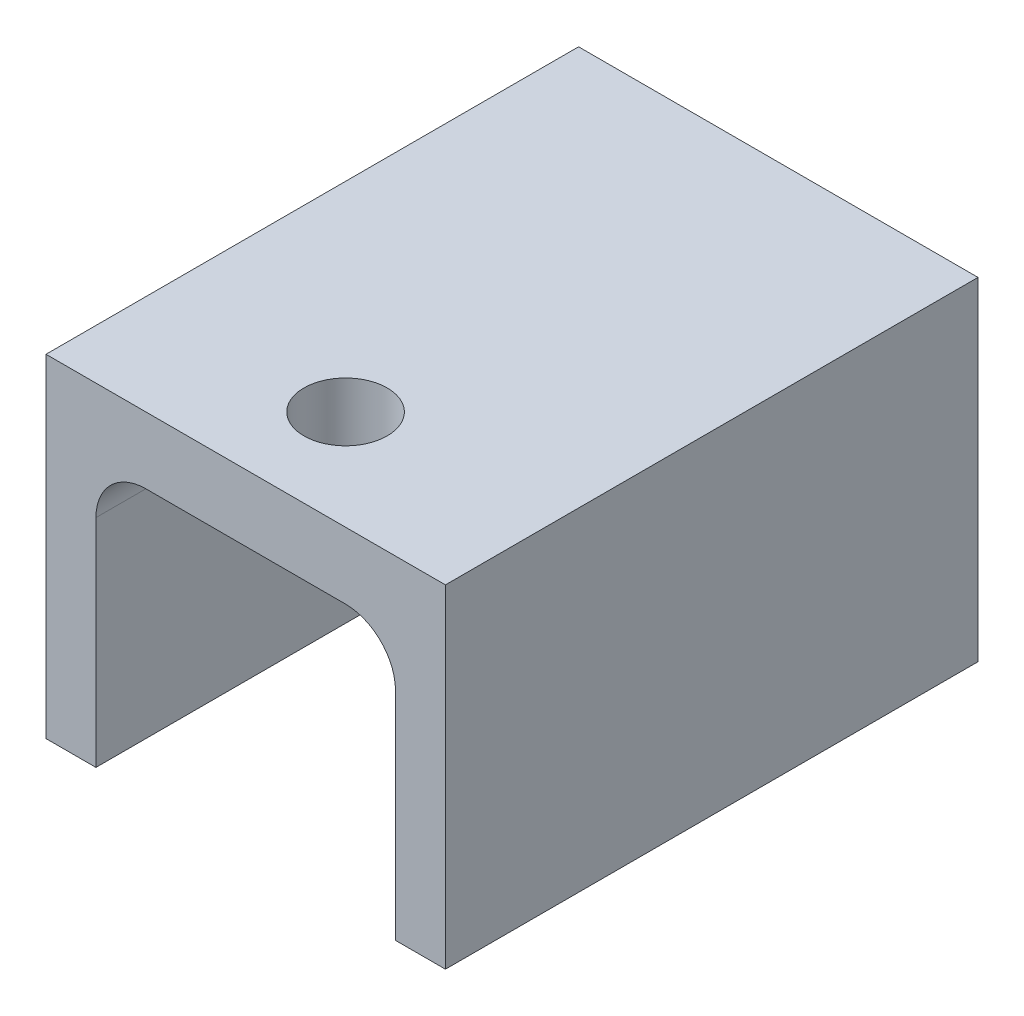
from build123d import *

# Parameters (mm, degrees)
SKETCH_1_W          = 18
SKETCH_1_H          = 20
EXTRUDE_1_DEPTH     = 4
SKETCH_2_W          = 18
SKETCH_2_H          = 4
EXTRUDE_2_DEPTH     = 28
SKETCH_3_R          = 2.5
CUT_EXTRUDE_1_DEPTH = 37.891733491
SKETCH_4_R          = 1.5
CUT_EXTRUDE_2_DEPTH = 32
EXTRUDE_3_DEPTH     = 3
EXTRUDE_4_DEPTH     = 3
EXTRUDE_5_DEPTH     = 3
EXTRUDE_6_DEPTH     = 3
FILLET_1_R          = 3


with BuildPart() as part:
    # 草图1 → 凸台-拉伸1 (new body)
    with BuildSketch(Plane.XY):
        Rectangle(SKETCH_1_W, SKETCH_1_H)
    extrude(amount=EXTRUDE_1_DEPTH)

    # 草图2 → 凸台-拉伸2 (add)
    with BuildSketch(Plane.XY.offset(4)):
        with Locations((0, 8)):
            Rectangle(SKETCH_2_W, SKETCH_2_H)
    extrude(amount=EXTRUDE_2_DEPTH)

    # 草图3 → 切除-拉伸1 (cut, through all)
    with BuildSketch(Plane.XZ.offset(-6)):
        with Locations(Location((0, 26, 0), (0, 0, 270))):
            Circle(SKETCH_3_R)
    extrude(amount=-CUT_EXTRUDE_1_DEPTH, mode=Mode.SUBTRACT)

    # 草图4 → 切除-拉伸2 (cut)
    with BuildSketch(Plane.XY.offset(4)):
        with Locations((-6, -0.25)):
            Circle(SKETCH_4_R)
        with Locations((-6, -6.75)):
            Circle(SKETCH_4_R)
        with Locations((6, -0.25)):
            Circle(SKETCH_4_R)
        with Locations((6, -6.75)):
            Circle(SKETCH_4_R)
    extrude(amount=-CUT_EXTRUDE_2_DEPTH, mode=Mode.SUBTRACT)

    # 草图5 → 凸台-拉伸3 (add)
    with BuildSketch(Plane(origin=(9, 0, 0), x_dir=(0, 0, -1), z_dir=(1, 0, 0))):
        Polygon((-32, 10), (0, 10), (0, -10), (-4, -10), (-32, 6), align=None)
    extrude(amount=EXTRUDE_3_DEPTH)

    # 草图6 → 凸台-拉伸4 (add)
    with BuildSketch(Plane.ZY.offset(9)):
        Polygon((0, -10), (0, 10), (32, 10), (32, 6), (4, -10), align=None)
    extrude(amount=EXTRUDE_4_DEPTH)

    # 草图7 → 凸台-拉伸5 (add)
    with BuildSketch(Plane.ZY.offset(12)):
        Polygon((32, 6), (4, -10), (32, -10), align=None)
    extrude(amount=-EXTRUDE_5_DEPTH)

    # 草图8 → 凸台-拉伸6 (add)
    with BuildSketch(Plane(origin=(12, 0, 0), x_dir=(0, 0, -1), z_dir=(1, 0, 0))):
        Polygon((-32, 6), (-4, -10), (-32, -10), align=None)
    extrude(amount=-EXTRUDE_6_DEPTH)

    # 圆角1
    fillet_1_edges = [part.edges().sort_by_distance(p)[0] for p in [
        (-9, 6, 18),
        (9, 6, 18),
    ]]
    fillet(fillet_1_edges, radius=FILLET_1_R)


solid = part.part
